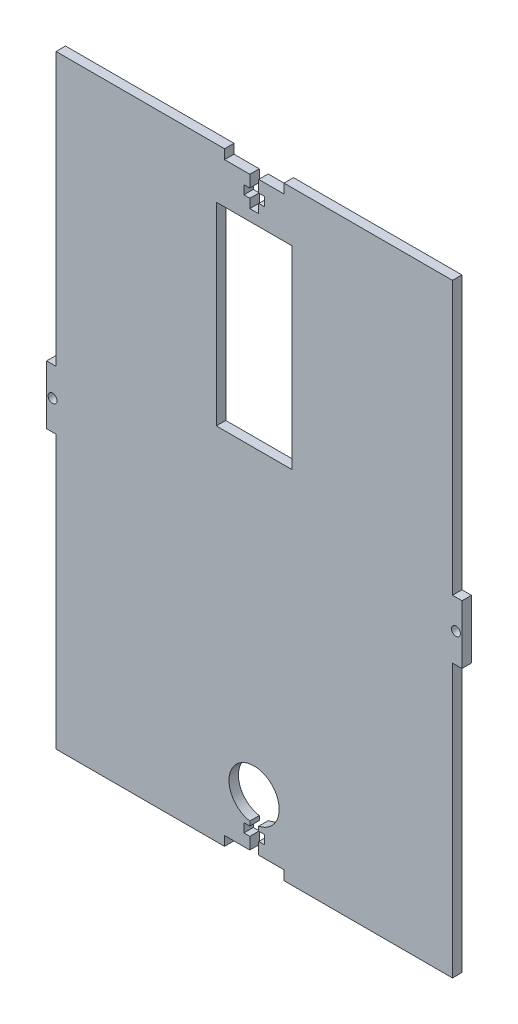
from build123d import *

# Parameters (mm, degrees)
SKETCH1_W           = 139.7
SKETCH1_H           = 203.2
BOSS_EXTRUDE1_DEPTH = 3.18
SKETCH2_R           = 1.5
SKETCH2_W           = 3.18
SKETCH2_H           = 91.725
CUT_EXTRUDE1_DEPTH  = 124.335700022
SKETCH3_R           = 8.441994665
CUT_EXTRUDE2_DEPTH  = 10
SKETCH5_W           = 25.530623926
SKETCH5_H           = 65.176444071
CUT_EXTRUDE3_DEPTH  = 10


with BuildPart() as part:
    # Sketch1 → Boss-Extrude1 (new body)
    with BuildSketch(Plane.XY):
        Rectangle(SKETCH1_W, SKETCH1_H)
    extrude(amount=BOSS_EXTRUDE1_DEPTH)

    # Sketch2 → Cut-Extrude1 (cut, through all)
    with BuildSketch(Plane.XY.offset(3.18)):
        with Locations((-67.85, 0)):
            Circle(SKETCH2_R)
        with Locations((67.85, 0)):
            Circle(SKETCH2_R)
        Polygon((-10, 101.6), (10, 101.6), (10, 98.42), (1.5, 98.42), (1.5, 94.42), (3.5, 94.42), (3.5, 91.42), (1.5, 91.42), (1.5, 88.42), (-1.5, 88.42), (-1.5, 91.42), (-3.5, 91.42), (-3.5, 94.42), (-1.5, 94.42), (-1.5, 98.42), (-10, 98.42), align=None)
        Polygon((-10, -101.6), (-10, -98.42), (-1.5, -98.42), (-1.5, -94.42), (-3.5, -94.42), (-3.5, -91.42), (-1.5, -91.42), (-1.5, -88.42), (1.5, -88.42), (1.5, -91.42), (3.5, -91.42), (3.5, -94.42), (1.5, -94.42), (1.5, -98.42), (10, -98.42), (10, -101.6), align=None)
        with Locations((-68.26, 55.7375)):
            Rectangle(SKETCH2_W, SKETCH2_H)
        with Locations((-68.26, -55.7375)):
            Rectangle(SKETCH2_W, SKETCH2_H)
        with Locations((68.26, -55.7375)):
            Rectangle(SKETCH2_W, SKETCH2_H)
        with Locations((68.26, 55.7375)):
            Rectangle(SKETCH2_W, SKETCH2_H)
    extrude(amount=-CUT_EXTRUDE1_DEPTH, mode=Mode.SUBTRACT)

    # Sketch3 → Cut-Extrude2 (cut)
    with BuildSketch(Plane(origin=(0, 0, 0), x_dir=(-1, 0, 0), z_dir=(0, 0, -1))):
        with Locations((0.068813102, -81.648638462)):
            Circle(SKETCH3_R)
    extrude(amount=-CUT_EXTRUDE2_DEPTH, mode=Mode.SUBTRACT)

    # Sketch5 → Cut-Extrude3 (cut)
    with BuildSketch(Plane(origin=(0, 0, 0), x_dir=(-1, 0, 0), z_dir=(0, 0, -1))):
        with Locations((0, 52.074409839)):
            Rectangle(SKETCH5_W, SKETCH5_H)
    extrude(amount=-CUT_EXTRUDE3_DEPTH, mode=Mode.SUBTRACT)


solid = part.part
